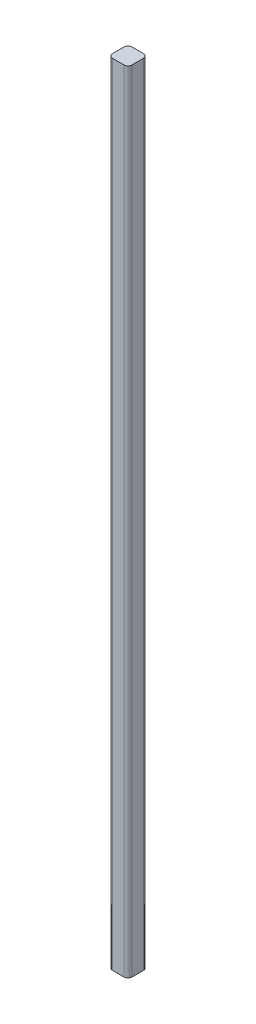
from build123d import *

# Parameters (mm, degrees)
RESSALTO_EXTRUS_O1_DEPTH = 405


with BuildPart() as part:
    # Esboço1 → Ressalto-extrusão1 (new body)
    with BuildSketch(Plane(origin=(0, 0, 0), x_dir=(1, 0, 0), z_dir=(0, 1, 0))):
        with BuildLine():
            Line((-3, -5), (3, -5))
            ThreePointArc((3, -5), (4.414213562, -4.414213562), (5, -3))
            Line((5, -3), (5, 3))
            ThreePointArc((5, 3), (4.414213562, 4.414213562), (3, 5))
            Line((3, 5), (-3, 5))
            ThreePointArc((-3, 5), (-4.414213562, 4.414213562), (-5, 3))
            Line((-5, 3), (-5, -3))
            ThreePointArc((-5, -3), (-4.414213562, -4.414213562), (-3, -5))
        make_face()
    extrude(amount=RESSALTO_EXTRUS_O1_DEPTH)


solid = part.part
